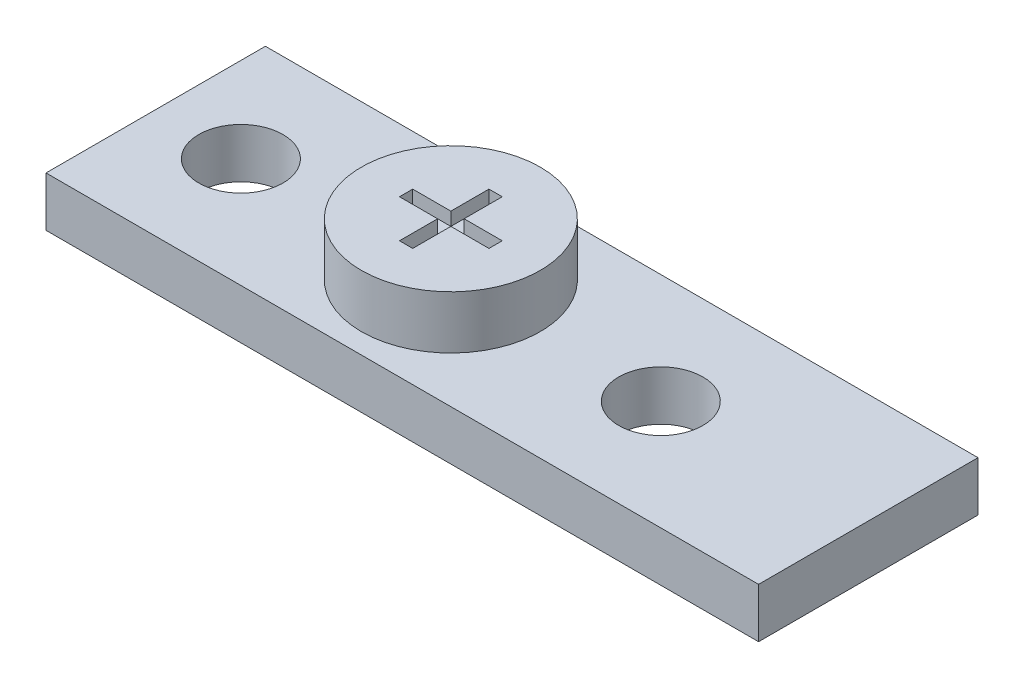
from build123d import *

# Parameters (mm, degrees)
SKETCH1_W                    = 27.305
SKETCH1_H                    = 8.4074
SKETCH1_R                    = 1.6129
BASE_PCB_DEPTH               = 1.905
SKETCH2_R                    = 3.429
SCREW_HEAD_UNSCREWED_DEPTH   = 2.032
SKETCH3_R                    = 2.921
THREADED_HOLE_BOSS_DEPTH     = 0.762
SKETCH4_R                    = 1.397
SCREW_STICKOUT_SCREWED_DEPTH = 0.889
SKETCH5_W                    = 0.508
SKETCH5_H                    = 1.4605
SKETCH5_W_2                  = 1.4605
SKETCH5_H_2                  = 0.508
F_2S_LIPO_MOUNTING_DEPTH     = 0.508


with BuildPart() as part:
    # Sketch1 → Base PCB (new body)
    with BuildSketch(Plane(origin=(0, 0, 0), x_dir=(1, 0, 0), z_dir=(0, 1, 0))):
        with Locations((13.6525, 4.2037)):
            Rectangle(SKETCH1_W, SKETCH1_H)
        with Locations(Location((3.2639, 4.2037, 0), (0, 0, 90))):
            Circle(SKETCH1_R, mode=Mode.SUBTRACT)
        with Locations(Location((19.3548, 4.2037, 0), (0, 0, 90))):
            Circle(SKETCH1_R, mode=Mode.SUBTRACT)
    extrude(amount=BASE_PCB_DEPTH)

    # Sketch2 → Screw Head (Unscrewed) (add)
    with BuildSketch(Plane(origin=(0, 1.905, 0), x_dir=(1, 0, 0), z_dir=(0, 1, 0))):
        with Locations(Location((11.30935, 4.2037, 0), (0, 0, 90))):
            Circle(SKETCH2_R)
    extrude(amount=SCREW_HEAD_UNSCREWED_DEPTH)

    # Sketch3 → Threaded Hole Boss (add)
    with BuildSketch(Plane.XZ):
        with Locations(Location((11.30935, -4.2037, 0), (0, 0, 90))):
            Circle(SKETCH3_R)
    extrude(amount=THREADED_HOLE_BOSS_DEPTH)

    # Sketch4 → Screw Stickout (Screwed) (add)
    with BuildSketch(Plane.XZ.offset(0.762)):
        with Locations(Location((11.30935, -4.2037, 0), (0, 0, 270))):
            Circle(SKETCH4_R)
    extrude(amount=SCREW_STICKOUT_SCREWED_DEPTH)

    # Sketch5 → 2s LiPo Mounting (cut)
    with BuildSketch(Plane(origin=(0, 3.937, 0), x_dir=(1, 0, 0), z_dir=(0, 1, 0))):
        with Locations((11.30935, 5.18795)):
            Rectangle(SKETCH5_W, SKETCH5_H)
        with Locations((10.3251, 4.2037)):
            Rectangle(SKETCH5_W_2, SKETCH5_H_2)
        with Locations((11.30935, 4.2037)):
            Rectangle(SKETCH5_W, SKETCH5_H_2)
        with Locations((11.30935, 3.21945)):
            Rectangle(SKETCH5_W, SKETCH5_H)
        with Locations((12.2936, 4.2037)):
            Rectangle(SKETCH5_W_2, SKETCH5_H_2)
    extrude(amount=-F_2S_LIPO_MOUNTING_DEPTH, mode=Mode.SUBTRACT)


solid = part.part
